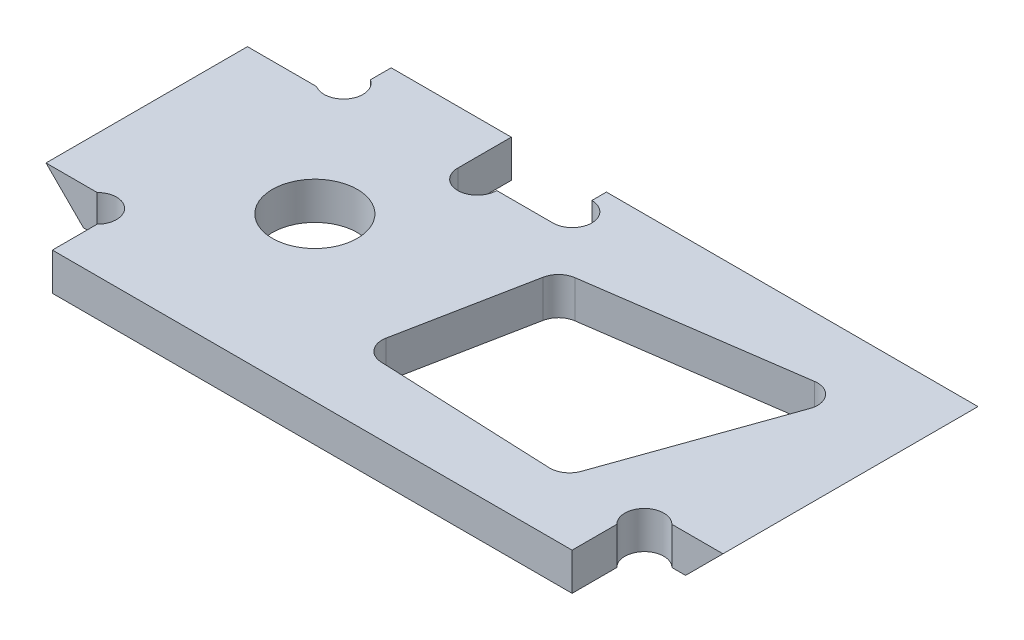
from build123d import *

# Parameters (mm, degrees)
SKETCH1_W           = 229.616
SKETCH1_H           = 110.998
BOSS_EXTRUDE1_DEPTH = 12.7
DRAFT1_ANGLE        = -45
CUT_EXTRUDE1_DEPTH  = 139.893248743
CUT_EXTRUDE2_DEPTH  = 139.893248743
CUT_EXTRUDE3_DEPTH  = 139.893248743
SKETCH5_R           = 14.406124238
CUT_EXTRUDE4_DEPTH  = 139.893248743


with BuildPart() as part:
    # Sketch1 → Boss-Extrude1 (new body)
    with BuildSketch(Plane(origin=(0, 0, 0), x_dir=(1, 0, 0), z_dir=(0, 1, 0))):
        with Locations((0, 21.631847801)):
            Rectangle(SKETCH1_W, SKETCH1_H)
    extrude(amount=BOSS_EXTRUDE1_DEPTH)

    # Draft1
    draft1_faces = [part.faces().sort_by_distance(p)[0] for p in [
        (-114.808, 6.35, -21.631847801),
        (114.808, 6.35, -21.631847801),
    ]]
    draft(draft1_faces, Plane.ZX.offset(12.7), DRAFT1_ANGLE)

    # Sketch2 → Cut-Extrude1 (cut, through all)
    with BuildSketch(Plane(origin=(0, 12.7, 0), x_dir=(1, 0, 0), z_dir=(0, 1, 0))):
        with BuildLine():
            Line((-114.808, -9.356152199), (-97.477466366, -9.356152199))
            ThreePointArc((-97.477466366, -9.356152199), (-88.138, -9.356152199), (-88.138, -18.695618565))
            Line((-88.138, -18.695618565), (-88.138, -33.867152199))
            Line((-88.138, -33.867152199), (-114.808, -33.867152199))
            Line((-114.808, -33.867152199), (-114.808, -9.356152199))
        make_face()
        with BuildLine():
            Line((114.808, -33.867152199), (114.808, -9.356152199))
            Line((114.808, -9.356152199), (97.477466366, -9.356152199))
            ThreePointArc((97.477466366, -9.356152199), (88.138, -9.356152199), (88.138, -18.695618565))
            Line((88.138, -18.695618565), (88.138, -33.867152199))
            Line((88.138, -33.867152199), (114.808, -33.867152199))
        make_face()
        with BuildLine():
            Line((-114.808, 58.969847801), (-91.336585113, 58.969847801))
            ThreePointArc((-91.336585113, 58.969847801), (-82.215723928, 60.978708985), (-84.224585113, 70.099570169))
            Line((-84.224585113, 70.099570169), (-84.224585113, 77.130847801))
            Line((-84.224585113, 77.130847801), (-114.808, 77.130847801))
            Line((-114.808, 77.130847801), (-114.808, 58.969847801))
        make_face()
    extrude(amount=-CUT_EXTRUDE1_DEPTH, mode=Mode.SUBTRACT)

    # Sketch3 → Cut-Extrude2 (cut, through all)
    with BuildSketch(Plane(origin=(0, 12.7, 0), x_dir=(1, 0, 0), z_dir=(0, 1, 0))):
        with BuildLine():
            Line((3.048, 41.385190987), (-5.690853499, -3.137191319))
            ThreePointArc((-5.690853499, -3.137191319), (-4.398442962, -8.495486175), (0.508, -11.007152199))
            Line((0.508, -11.007152199), (60.043235464, -13.547152199))
            ThreePointArc((60.043235464, -13.547152199), (64.017965036, -12.423899948), (66.548, -9.159073174))
            Line((66.548, -9.159073174), (86.868, 48.063309133))
            ThreePointArc((86.868, 48.063309133), (85.755892247, 54.455195083), (79.710737995, 56.810847801))
            Line((79.710737995, 56.810847801), (8.59435603, 46.650847801))
            ThreePointArc((8.59435603, 46.650847801), (4.981382787, 44.902582041), (3.048, 41.385190987))
        make_face()
    extrude(amount=-CUT_EXTRUDE2_DEPTH, mode=Mode.SUBTRACT)

    # Sketch4 → Cut-Extrude3 (cut, through all)
    with BuildSketch(Plane.XZ):
        with BuildLine():
            Line((-43.477968603, -77.130847801), (-43.477968603, -58.969847801))
            ThreePointArc((-43.477968603, -58.969847801), (-36.873968603, -52.365847801), (-30.269968603, -58.969847801))
            Line((-30.269968603, -58.969847801), (-11.219968603, -58.969847801))
            ThreePointArc((-11.219968603, -58.969847801), (-4.615968603, -65.573847801), (-11.219968603, -72.177847801))
            Line((-11.219968603, -72.177847801), (-11.219968603, -77.130847801))
            Line((-11.219968603, -77.130847801), (-43.477968603, -77.130847801))
        make_face()
    extrude(amount=-CUT_EXTRUDE3_DEPTH, mode=Mode.SUBTRACT)

    # Sketch5 → Cut-Extrude4 (cut, through all)
    with BuildSketch(Plane.XZ):
        with Locations(Location((-54.2628102, -21.286098046, 0), (0, 0, 270))):
            Circle(SKETCH5_R)
    extrude(amount=-CUT_EXTRUDE4_DEPTH, mode=Mode.SUBTRACT)


solid = part.part
